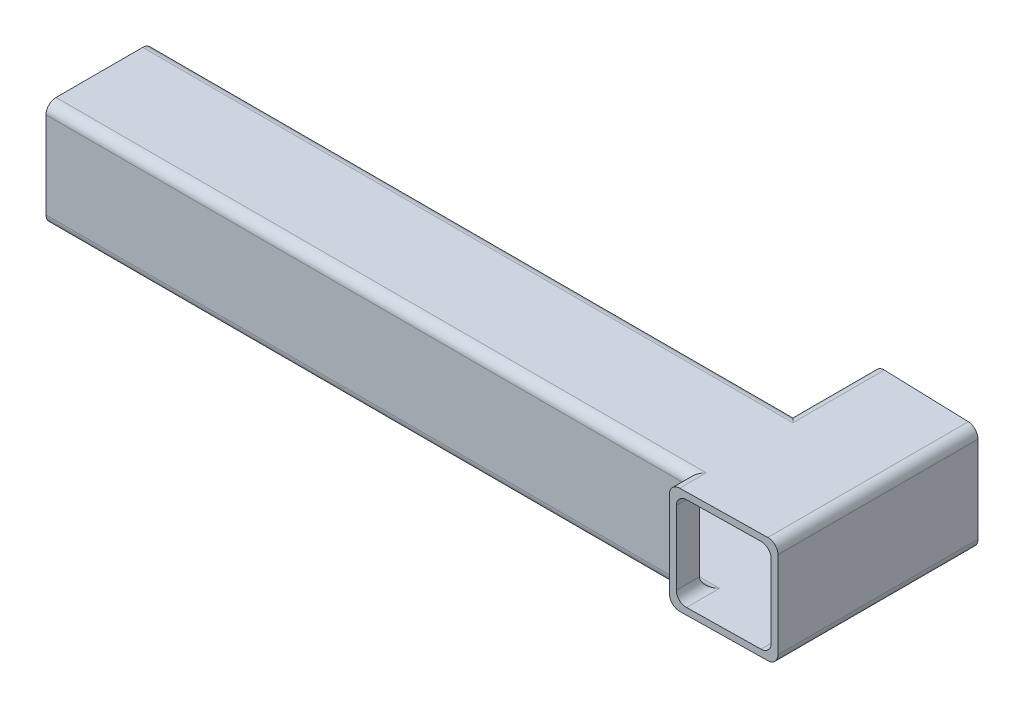
from build123d import *

# Parameters (mm, degrees)
SKETCH1_W                = 50.8
SKETCH1_H                = 50.8
SKETCH1_W_2              = 44.45
SKETCH1_H_2              = 44.45
BOSS_EXTRUDE1_DEPTH      = 304.8
BOSS_EXTRUDE2_DEPTH      = 7.9375
BOSS_EXTRUDE2_DEPTH_BACK = 89.69375
SKETCH2_W                = 50.8254
SKETCH2_H                = 50.8
SKETCH2_W_2              = 44.4754
SKETCH2_H_2              = 44.45
CUT_EXTRUDE1_DEPTH       = 371.251267642
FILLET1_R                = 4.7625
CUT_EXTRUDE2_START       = 304.7873
SKETCH1_3_W              = 44.45
SKETCH1_3_H              = 44.45
CUT_EXTRUDE2_DEPTH       = 3.175
FILLET3_R                = 4.7625


with BuildPart() as part:
    # Sketch1 → Boss-Extrude1 (new body)
    with BuildSketch(Plane(origin=(0, 0, 0), x_dir=(0, 0, -1), z_dir=(1, 0, 0))):
        with Locations((25.4, 0)):
            Rectangle(SKETCH1_W, SKETCH1_H)
        with Locations((25.4, 0)):
            Rectangle(SKETCH1_W_2, SKETCH1_H_2, mode=Mode.SUBTRACT)
    extrude(amount=BOSS_EXTRUDE1_DEPTH)

    # Sketch2 → Boss-Extrude2 (add, two sides: drawn at the far end of the back side and taken through both)
    with BuildSketch(Plane.XY.offset(-BOSS_EXTRUDE2_DEPTH_BACK)):
        with Locations((330.2, 0)):
            Rectangle(SKETCH2_W, SKETCH2_H)
        with Locations((330.2, 0)):
            Rectangle(SKETCH2_W_2, SKETCH2_H_2, mode=Mode.SUBTRACT)
    extrude(amount=BOSS_EXTRUDE2_DEPTH + BOSS_EXTRUDE2_DEPTH_BACK)

    # Sketch3 → Cut-Extrude1 (cut, through all)
    with BuildSketch(Plane(origin=(0, 25.4, 0), x_dir=(1, 0, 0), z_dir=(0, 1, 0))):
        Polygon((304.7873, 89.69375), (355.6127, 88.10625), (355.6127, 89.69375), align=None)
        Polygon((304.7873, -7.9375), (355.6127, -7.14375), (355.6127, -7.9375), align=None)
    extrude(amount=-CUT_EXTRUDE1_DEPTH, mode=Mode.SUBTRACT)

    # Fillet1
    fillet1_edges = [part.edges().sort_by_distance(p)[0] for p in [
        (152.39365, -25.4, 0),
        (152.39365, 25.4, 0),
        (152.39365, 25.4, -50.8),
        (152.39365, -25.4, -50.8),
        (304.7873, -25.4, -70.246875),
        (304.7873, -25.4, 3.96875),
        (304.7873, 25.4, -70.246875),
        (304.7873, 25.4, 3.96875),
        (355.6127, 25.4, -40.48125),
        (355.6127, -25.4, -40.48125),
    ]]
    fillet(fillet1_edges, radius=FILLET1_R)

    # Sketch1<3> → Cut-Extrude2 (cut)
    with BuildSketch(Plane(origin=(0, 0, 0), x_dir=(0, 0, -1), z_dir=(1, 0, 0)).offset(CUT_EXTRUDE2_START)):
        with Locations((25.4, 0)):
            Rectangle(SKETCH1_3_W, SKETCH1_3_H)
    extrude(amount=CUT_EXTRUDE2_DEPTH, mode=Mode.SUBTRACT)

    # Fillet3
    fillet3_edges = [part.edges().sort_by_distance(p)[0] for p in [
        (307.9623, 22.225, 2.356457709),
        (307.9623, -22.225, 2.356457709),
        (153.98115, -22.225, -47.625),
        (153.98115, 22.225, -47.625),
        (153.98115, 22.225, -3.175),
        (153.98115, -22.225, -3.175),
        (307.9623, -22.225, -68.609790417),
        (352.4377, -22.225, -40.506042291),
        (352.4377, 22.225, -40.506042291),
        (307.9623, 22.225, -68.609790417),
    ]]
    fillet(fillet3_edges, radius=FILLET3_R)


solid = part.part
